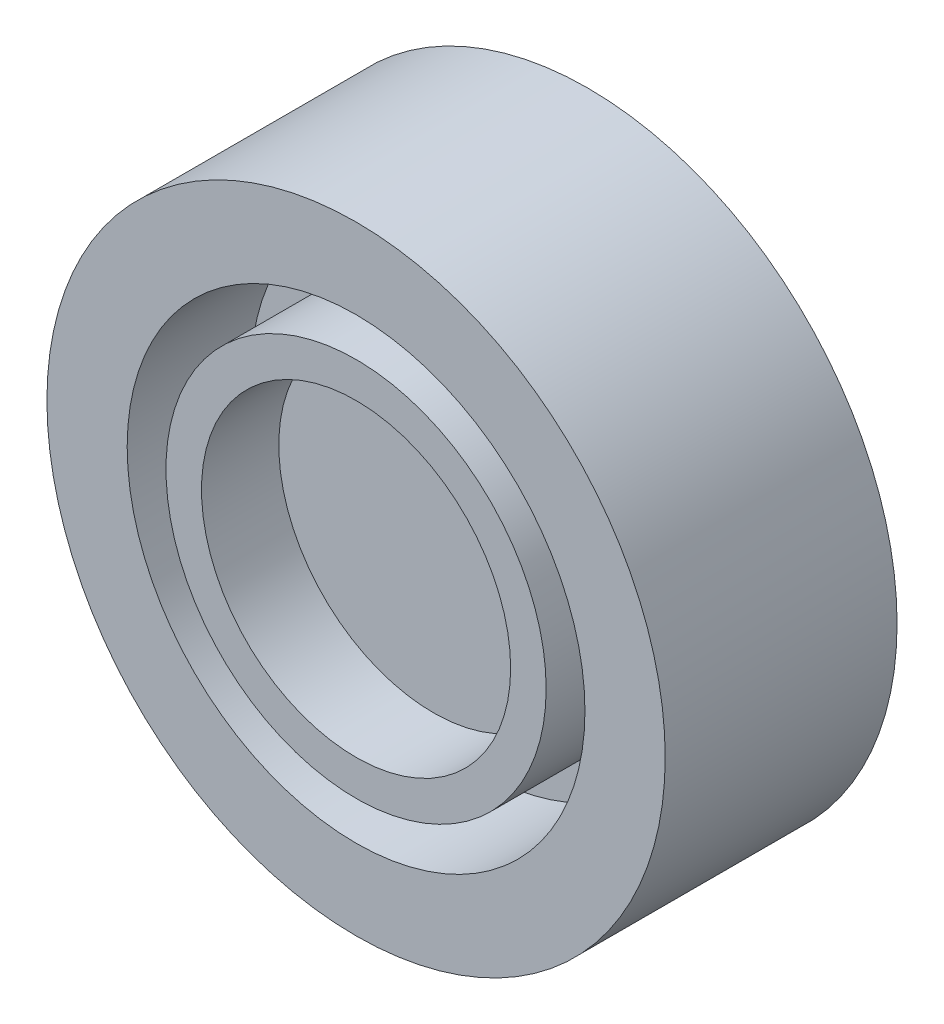
from build123d import *

# Parameters (mm, degrees)
SKETCH1_R           = 20
BOSS_EXTRUDE1_DEPTH = 15
SKETCH2_R           = 10
CUT_EXTRUDE2_DEPTH  = 5
SKETCH4_R           = 14.80787709
SKETCH4_R_2         = 12.298169838
CUT_EXTRUDE3_DEPTH  = 8


with BuildPart() as part:
    # Sketch1 → Boss-Extrude1 (new body)
    with BuildSketch(Plane.XY):
        Circle(SKETCH1_R)
    extrude(amount=BOSS_EXTRUDE1_DEPTH)

    # Sketch2 → Cut-Extrude2 (cut)
    with BuildSketch(Plane.XY.offset(15)):
        Circle(SKETCH2_R)
    extrude(amount=-CUT_EXTRUDE2_DEPTH, mode=Mode.SUBTRACT)

    # Sketch4 → Cut-Extrude3 (cut)
    with BuildSketch(Plane.XY.offset(15)):
        Circle(SKETCH4_R)
        Circle(SKETCH4_R_2, mode=Mode.SUBTRACT)
    extrude(amount=-CUT_EXTRUDE3_DEPTH, mode=Mode.SUBTRACT)


solid = part.part
